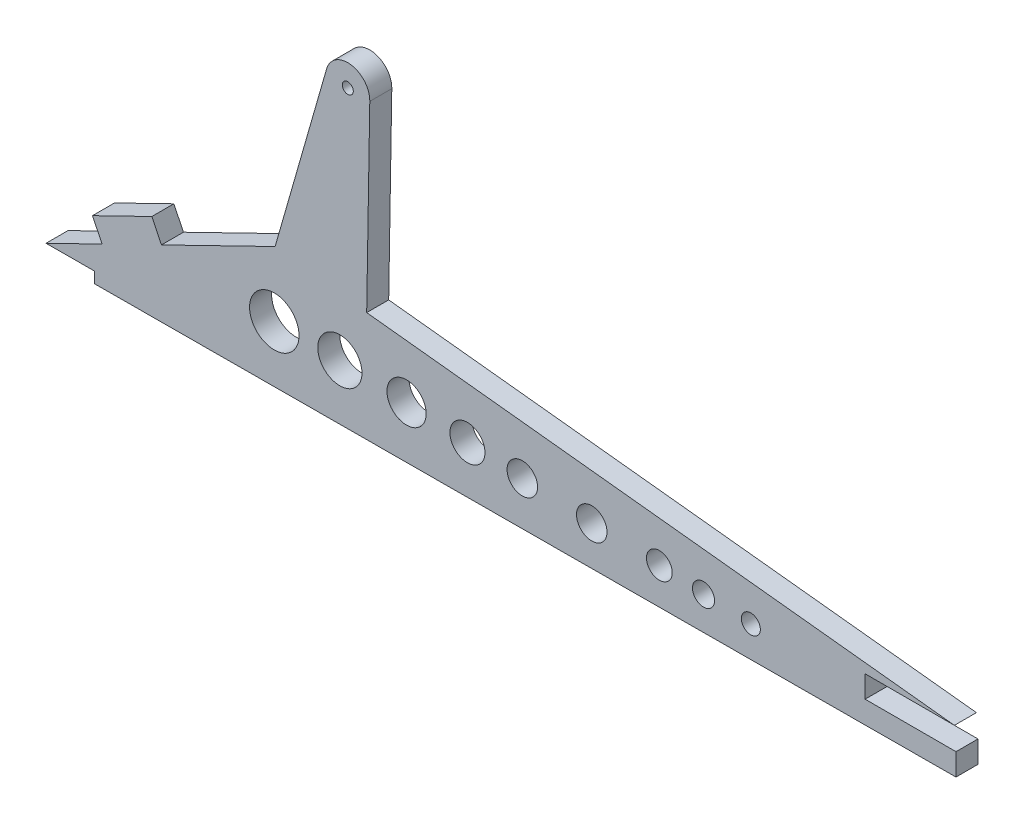
from build123d import *

# Parameters (mm, degrees)
MODEL_R         = 0.5
MODEL_R_2       = 1.782992023
MODEL_R_3       = 1.590607237
MODEL_R_4       = 1.168321926
MODEL_R_5       = 1.005990221
MODEL_R_6       = 0.862372678
MODEL_R_7       = 1.386768465
MODEL_R_8       = 2.007691982
MODEL_R_9       = 2.246211192
EXTRUDE_1_DEPTH = 2


with BuildPart() as part:
    # Model → 凸台-拉伸1 (new body)
    with BuildSketch(Plane.XY):
        with BuildLine():
            Line((7.038065488, 6.287794997), (6.161323194, 8.085383089))
            Line((6.161323194, 8.085383089), (11.554087472, 10.71560997))
            Line((11.554087472, 10.71560997), (12.430829766, 8.918021877))
            Line((12.430829766, 8.918021877), (22.753800963, 13.952871341))
            Line((22.753800963, 13.952871341), (27.429909526, 30.259640434))
            ThreePointArc((27.429909526, 30.259640434), (29.651920806, 31.70137695), (31.356032886, 29.673584966))
            Line((31.356032886, 29.673584966), (31.073854544, 12.913284736))
            Line((31.073854544, 12.913284736), (84.46937713, 7.138642034))
            Line((84.46937713, 7.138642034), (76.356996628, 7.138642034))
            Line((76.356996628, 7.138642034), (76.356996628, 5.138642034))
            Line((76.356996628, 5.138642034), (84.613173024, 5.138642034))
            Line((84.613173024, 5.138642034), (84.613173024, 3.138642034))
            Line((84.613173024, 3.138642034), (39.080128632, 2.952174352))
            Line((39.080128632, 2.952174352), (6.368039675, 2.818983184))
            Line((6.368039675, 2.818983184), (6.36396809, 3.818974895))
            Line((6.36396809, 3.818974895), (1.939296742, 3.800959318))
            Line((1.939296742, 3.800959318), (7.038065488, 6.287794997))
        make_face()
        with Locations((29.356650707, 29.723293138)):
            Circle(MODEL_R, mode=Mode.SUBTRACT)
        with Locations((34.697579439, 7.654463755)):
            Circle(MODEL_R_2, mode=Mode.SUBTRACT)
        with Locations((40.228196013, 7.265180246)):
            Circle(MODEL_R_3, mode=Mode.SUBTRACT)
        with Locations((57.662403713, 6.323039134)):
            Circle(MODEL_R_4, mode=Mode.SUBTRACT)
        with Locations((61.677618383, 6.049673892)):
            Circle(MODEL_R_5, mode=Mode.SUBTRACT)
        with Locations((65.97541766, 5.870473213)):
            Circle(MODEL_R_6, mode=Mode.SUBTRACT)
        with Locations((45.214294389, 6.944127982)):
            Circle(MODEL_R_7, mode=Mode.SUBTRACT)
        with Locations((28.636152213, 7.943525557)):
            Circle(MODEL_R_8, mode=Mode.SUBTRACT)
        with Locations((22.680090468, 8.022724278)):
            Circle(MODEL_R_9, mode=Mode.SUBTRACT)
        with Locations((51.523752732, 6.556908357)):
            Circle(MODEL_R_7, mode=Mode.SUBTRACT)
    extrude(amount=EXTRUDE_1_DEPTH)


solid = part.part
